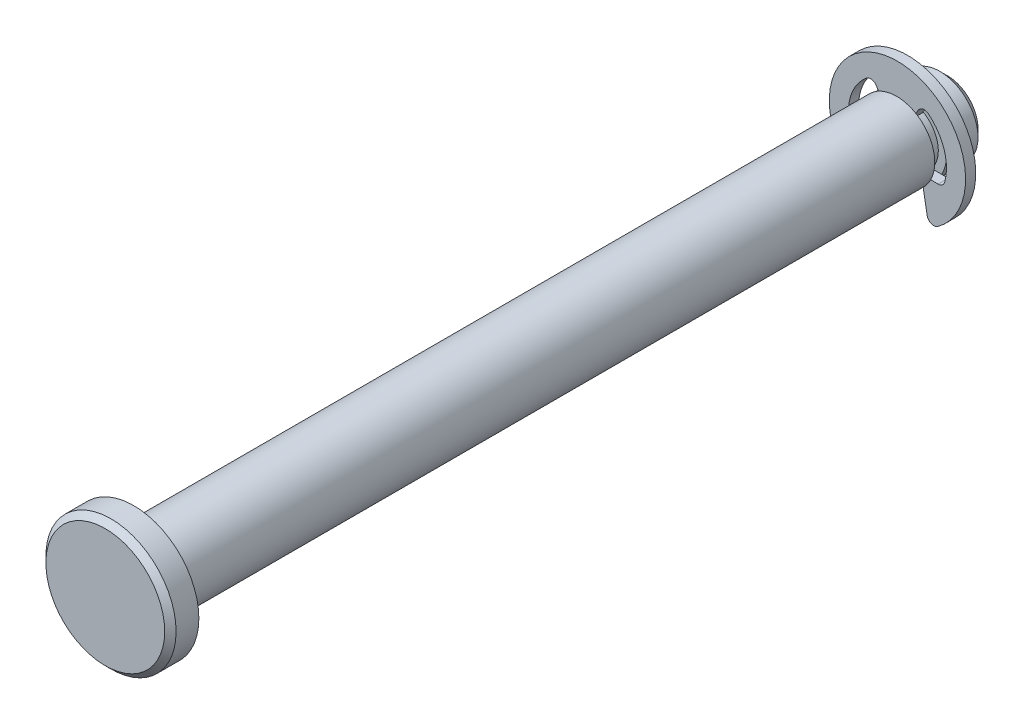
from build123d import *

# Parameters (mm, degrees)
SKETCH2_R      = 2.38125
EXTRUDE1_DEPTH = 25.4
SKETCH3_W      = 0.7366
SKETCH3_H      = 0.51435
SKETCH8_R      = 4.064
EXTRUDE6_DEPTH = 1.778
CHAMFER2_SIZE  = 0.3556
SKETCH4_R      = 4.2545
SKETCH4_R_2    = 1.8669
EXTRUDE2_DEPTH = 0.3175
EXTRUDE4_DEPTH = 28.836041825
EXTRUDE5_DEPTH = 0.635
FILLET1_R      = 0.42545
CHAMFER1_SIZE  = 0.47625


with BuildPart() as part:
    # Sketch2 → Extrude1 (new, symmetric)
    with BuildSketch(Plane.XY):
        Circle(SKETCH2_R)
    extrude(amount=EXTRUDE1_DEPTH, both=True)

    # Sketch3 → Cut-Revolve1 (revolve, cut)
    with BuildSketch(Plane(origin=(0, 0, 0), x_dir=(0, 0, -1), z_dir=(1, 0, 0)), mode=Mode.PRIVATE) as cut_revolve1_sk:
        with Locations((22.5933, 2.124075)):
            Rectangle(SKETCH3_W, SKETCH3_H)
    revolve(cut_revolve1_sk.sketch.rotate(Axis((0, 0, 25.4), (0, 0, -1)), 90), axis=Axis((0, 0, 25.4), (0, 0, -1)), mode=Mode.SUBTRACT)

    # Sketch8 → Extrude6 (add)
    with BuildSketch(Plane.XY.offset(25.4)):
        Circle(SKETCH8_R)
    extrude(amount=EXTRUDE6_DEPTH)

    # Chamfer2
    chamfer2_edges = [part.edges().sort_by_distance(p)[0] for p in [
        (-4.064, 0, 27.178),
    ]]
    chamfer(chamfer2_edges, length=CHAMFER2_SIZE)

    # Chamfer1
    chamfer1_edges = [part.edges().sort_by_distance(p)[0] for p in [
        (-2.38125, 0, -25.4),
    ]]
    chamfer(chamfer1_edges, length=CHAMFER1_SIZE)


with BuildPart() as body_2:
    # Sketch4 → Extrude2 (new, symmetric)
    with BuildSketch(Plane.XY.offset(-22.5933)):
        Circle(SKETCH4_R)
        Circle(SKETCH4_R_2, mode=Mode.SUBTRACT)
    extrude(amount=EXTRUDE2_DEPTH, both=True)

    # Sketch5 → Extrude4 (cut, through all)
    with BuildSketch(Plane.XY):
        with BuildLine():
            Line((-1.53035, 2.650643953), (0, 0))
            Line((0, 0), (1.53035, 2.650643953))
            ThreePointArc((1.53035, 2.650643953), (2.889287878, 1.00990101), (2.84836284, -1.12014))
            Line((2.84836284, -1.12014), (1.49352, -1.12014))
            Line((1.49352, -1.12014), (1.96168838, -3.775254819))
            ThreePointArc((1.96168838, -3.775254819), (0, -4.2545), (-1.96168838, -3.775254819))
            Line((-1.96168838, -3.775254819), (-1.49352, -1.12014))
            Line((-1.49352, -1.12014), (-2.84836284, -1.12014))
            ThreePointArc((-2.84836284, -1.12014), (-2.889287878, 1.00990101), (-1.53035, 2.650643953))
        make_face()
    extrude(amount=-EXTRUDE4_DEPTH, mode=Mode.SUBTRACT)

    # Sketch6 → Extrude5 (add)
    with BuildSketch(Plane.XY.offset(-22.2758)):
        with BuildLine():
            Line((-0.93345, 1.616782826), (0.93345, 1.616782826))
            ThreePointArc((0.93345, 1.616782826), (0, 1.8669), (-0.93345, 1.616782826))
        make_face()
    extrude(amount=-EXTRUDE5_DEPTH)

    # Fillet1
    fillet1_edges = [body_2.edges().sort_by_distance(p)[0] for p in [
        (1.53035, 2.650643953, -22.5933),
        (1.96168838, -3.775254819, -22.5933),
        (-2.84836284, -1.12014, -22.5933),
        (2.84836284, -1.12014, -22.5933),
        (-1.96168838, -3.775254819, -22.5933),
        (-1.53035, 2.650643953, -22.5933),
    ]]
    fillet(fillet1_edges, radius=FILLET1_R)


solid = Compound([part.part, body_2.part])
